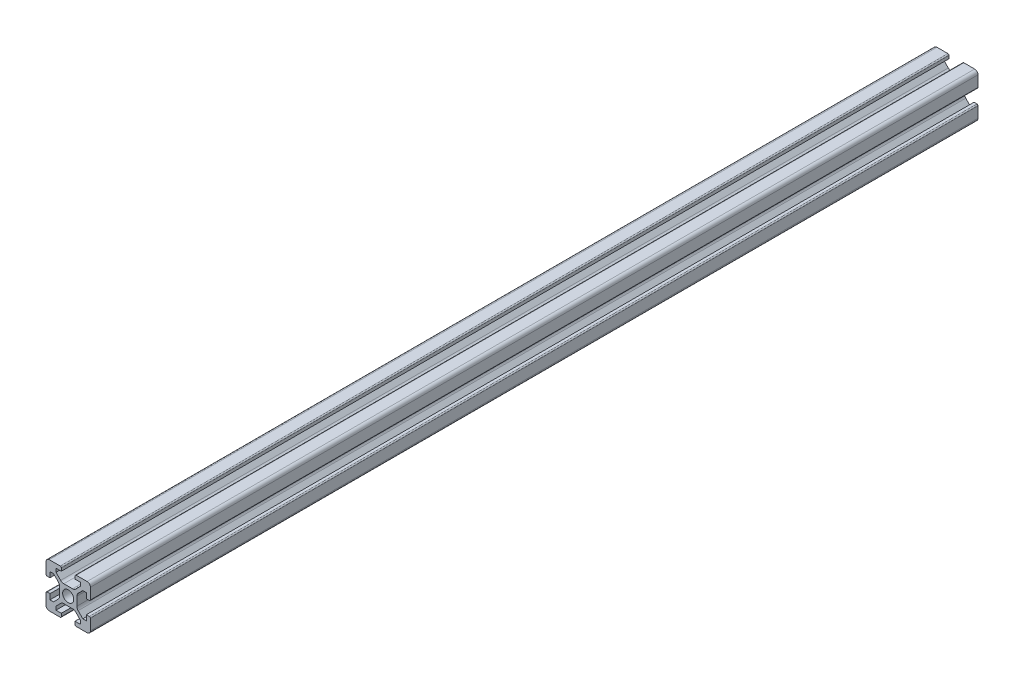
from build123d import *

# Parameters (mm, degrees)
SKETCH_1_R      = 2.5
EXTRUDE_1_DEPTH = 400


with BuildPart() as part:
    # 草图1 → 凸台-拉伸1 (new body)
    with BuildSketch(Plane.XY):
        with BuildLine():
            Line((3.9, 0), (3.9, 1.971572875))
            ThreePointArc((3.9, 1.971572875), (4.052240935, 2.73693974), (4.485786438, 3.385786438))
            Line((4.485786438, 3.385786438), (6.6, 5.5))
            Line((6.6, 5.5), (8.2, 5.5))
            Line((8.2, 5.5), (8.2, 3.1))
            Line((8.2, 3.1), (9.5, 3.1))
            ThreePointArc((9.5, 3.1), (9.853553391, 3.246446609), (10, 3.6))
            Line((10, 3.6), (10, 8.5))
            ThreePointArc((10, 8.5), (9.560660172, 9.560660172), (8.5, 10))
            Line((8.5, 10), (3.6, 10))
            ThreePointArc((3.6, 10), (3.246446609, 9.853553391), (3.1, 9.5))
            Line((3.1, 9.5), (3.1, 8.2))
            Line((3.1, 8.2), (5.5, 8.2))
            Line((5.5, 8.2), (5.5, 6.6))
            Line((5.5, 6.6), (3.385786438, 4.485786438))
            ThreePointArc((3.385786438, 4.485786438), (2.73693974, 4.052240935), (1.971572875, 3.9))
            Line((1.971572875, 3.9), (0, 3.9))
            Line((0, 3.9), (-1.971572875, 3.9))
            ThreePointArc((-1.971572875, 3.9), (-2.73693974, 4.052240935), (-3.385786438, 4.485786438))
            Line((-3.385786438, 4.485786438), (-5.5, 6.6))
            Line((-5.5, 6.6), (-5.5, 8.2))
            Line((-5.5, 8.2), (-3.1, 8.2))
            Line((-3.1, 8.2), (-3.1, 9.5))
            ThreePointArc((-3.1, 9.5), (-3.246446609, 9.853553391), (-3.6, 10))
            Line((-3.6, 10), (-8.5, 10))
            ThreePointArc((-8.5, 10), (-9.560660172, 9.560660172), (-10, 8.5))
            Line((-10, 8.5), (-10, 3.6))
            ThreePointArc((-10, 3.6), (-9.853553391, 3.246446609), (-9.5, 3.1))
            Line((-9.5, 3.1), (-8.2, 3.1))
            Line((-8.2, 3.1), (-8.2, 5.5))
            Line((-8.2, 5.5), (-6.6, 5.5))
            Line((-6.6, 5.5), (-4.485786438, 3.385786438))
            ThreePointArc((-4.485786438, 3.385786438), (-4.052240935, 2.73693974), (-3.9, 1.971572875))
            Line((-3.9, 1.971572875), (-3.9, 0))
            Line((-3.9, 0), (-3.9, -1.971572875))
            ThreePointArc((-3.9, -1.971572875), (-4.052240935, -2.73693974), (-4.485786438, -3.385786438))
            Line((-4.485786438, -3.385786438), (-6.6, -5.5))
            Line((-6.6, -5.5), (-8.2, -5.5))
            Line((-8.2, -5.5), (-8.2, -3.1))
            Line((-8.2, -3.1), (-9.5, -3.1))
            ThreePointArc((-9.5, -3.1), (-9.853553391, -3.246446609), (-10, -3.6))
            Line((-10, -3.6), (-10, -8.5))
            ThreePointArc((-10, -8.5), (-9.560660172, -9.560660172), (-8.5, -10))
            Line((-8.5, -10), (-3.6, -10))
            ThreePointArc((-3.6, -10), (-3.246446609, -9.853553391), (-3.1, -9.5))
            Line((-3.1, -9.5), (-3.1, -8.2))
            Line((-3.1, -8.2), (-5.5, -8.2))
            Line((-5.5, -8.2), (-5.5, -6.6))
            Line((-5.5, -6.6), (-3.385786438, -4.485786438))
            ThreePointArc((-3.385786438, -4.485786438), (-2.73693974, -4.052240935), (-1.971572875, -3.9))
            Line((-1.971572875, -3.9), (0, -3.9))
            Line((0, -3.9), (1.971572875, -3.9))
            ThreePointArc((1.971572875, -3.9), (2.73693974, -4.052240935), (3.385786438, -4.485786438))
            Line((3.385786438, -4.485786438), (5.5, -6.6))
            Line((5.5, -6.6), (5.5, -8.2))
            Line((5.5, -8.2), (3.1, -8.2))
            Line((3.1, -8.2), (3.1, -9.5))
            ThreePointArc((3.1, -9.5), (3.246446609, -9.853553391), (3.6, -10))
            Line((3.6, -10), (8.5, -10))
            ThreePointArc((8.5, -10), (9.560660172, -9.560660172), (10, -8.5))
            Line((10, -8.5), (10, -3.6))
            ThreePointArc((10, -3.6), (9.853553391, -3.246446609), (9.5, -3.1))
            Line((9.5, -3.1), (8.2, -3.1))
            Line((8.2, -3.1), (8.2, -5.5))
            Line((8.2, -5.5), (6.6, -5.5))
            Line((6.6, -5.5), (4.485786438, -3.385786438))
            ThreePointArc((4.485786438, -3.385786438), (4.052240935, -2.73693974), (3.9, -1.971572875))
            Line((3.9, -1.971572875), (3.9, 0))
        make_face()
        Circle(SKETCH_1_R, mode=Mode.SUBTRACT)
    extrude(amount=EXTRUDE_1_DEPTH)


solid = part.part
